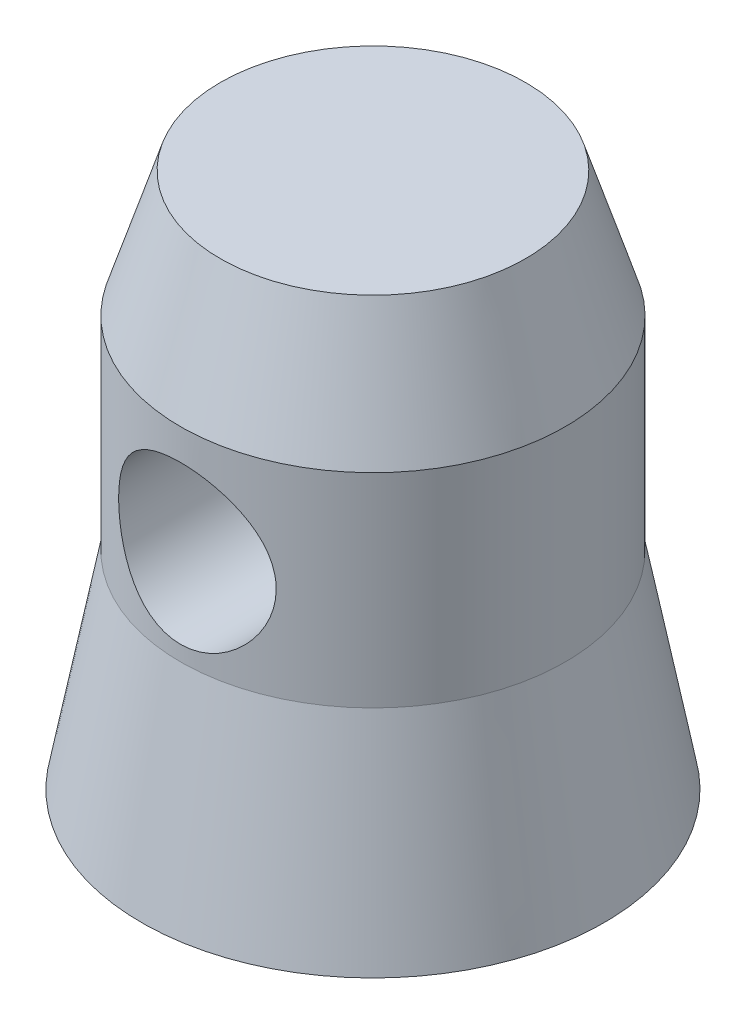
from build123d import *

# Parameters (mm, degrees)
CUT_EXTRUDE1_DEPTH         = 47.945551288
CUT_EXTRUDE1_DEPTH_BACK    = 47.945551288
SKETCH2_R                  = 5.8928
M10X1_5_TAPPED_HOLE1_D     = 8.5
M10X1_5_TAPPED_HOLE1_DEPTH = 9.2456
M10X1_5_TAPPED_HOLE1_TIP   = 2.553657631


with BuildPart() as part:
    # Sketch1 → Revolve1 (revolve)
    with BuildSketch(Plane.XY, mode=Mode.PRIVATE) as revolve1_sk:
        Polygon((0, 40.0685), (0, 3.31), (5, 3.31), (10.5974, 0), (17.2974, 0), (14.3891, 15.432044722), (14.3891, 30.672044722), (11.4173, 40.0685), align=None)
    revolve(revolve1_sk.sketch.rotate(Axis((0, 40.0685, 0), (0, -1, 0)), 180), axis=Axis((0, 40.0685, 0), (0, -1, 0)))

    # Sketch2 → Cut-Extrude1 (cut, two sides: drawn at the far end of the back side and taken through both)
    with BuildSketch(Plane.XY.offset(-CUT_EXTRUDE1_DEPTH_BACK)):
        with Locations((0, 22.4663)):
            Circle(SKETCH2_R)
    extrude(amount=CUT_EXTRUDE1_DEPTH + CUT_EXTRUDE1_DEPTH_BACK, mode=Mode.SUBTRACT)

    # M10x1.5 Tapped Hole1
    with Locations(Plane(origin=(0, 3.31, 0), x_dir=(-1, 0, 0), z_dir=(0, -1, 0))):
        with Locations((0, 0)):
            Hole(M10X1_5_TAPPED_HOLE1_D / 2, depth=M10X1_5_TAPPED_HOLE1_DEPTH)
            with Locations((0, 0, -(M10X1_5_TAPPED_HOLE1_DEPTH + M10X1_5_TAPPED_HOLE1_TIP / 2))):  # 118° drill point
                Cone(0, M10X1_5_TAPPED_HOLE1_D / 2, M10X1_5_TAPPED_HOLE1_TIP, mode=Mode.SUBTRACT)


solid = part.part
